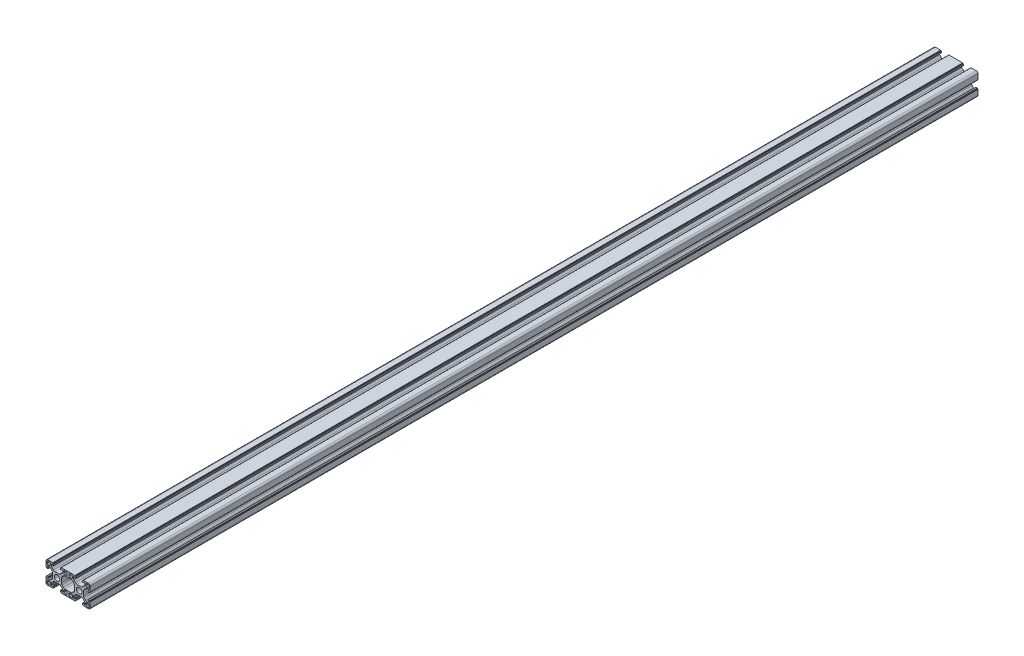
from build123d import *

# Parameters (mm, degrees)
EXTRUDE_1_DEPTH = 804


with BuildPart() as part:
    # Эскиз1 → Бобышка-Вытянуть1 (new body)
    with BuildSketch(Plane.XY):
        with BuildLine():
            Line((8.859007545, 4.035699369), (10.757788214, 4.035699369))
            ThreePointArc((10.757788214, 4.035699369), (11.523155079, 4.187940304), (12.172001777, 4.621485807))
            Line((12.172001777, 4.621485807), (13.473221107, 5.922705138))
            ThreePointArc((13.473221107, 5.922705138), (13.90676661, 6.571551836), (14.059007545, 7.3369187))
            Line((14.059007545, 7.3369187), (14.059007545, 8.235699369))
            ThreePointArc((14.059007545, 8.235699369), (13.912560936, 8.58925276), (13.559007545, 8.735699369))
            Line((13.559007545, 8.735699369), (13.456114326, 8.735699369))
            ThreePointArc((13.456114326, 8.735699369), (13.26477261, 8.697639136), (13.102560936, 8.58925276))
            Line((13.102560936, 8.58925276), (12.62223085, 8.108922674))
            ThreePointArc((12.62223085, 8.108922674), (12.541125013, 8.054729486), (12.445454154, 8.035699369))
            Line((12.445454154, 8.035699369), (12.159007545, 8.035699369))
            ThreePointArc((12.159007545, 8.035699369), (11.98223085, 8.108922674), (11.909007545, 8.285699369))
            Line((11.909007545, 8.285699369), (11.909007545, 9.43477019))
            ThreePointArc((11.909007545, 9.43477019), (11.952941528, 9.540836207), (12.059007545, 9.58477019))
            Line((12.059007545, 9.58477019), (12.559007545, 9.58477019))
            Line((12.559007545, 9.58477019), (12.559007545, 9.885699369))
            ThreePointArc((12.559007545, 9.885699369), (12.602941528, 9.991765387), (12.709007545, 10.035699369))
            Line((12.709007545, 10.035699369), (17.359007545, 10.035699369))
            ThreePointArc((17.359007545, 10.035699369), (18.419667717, 9.596359541), (18.859007545, 8.535699369))
            Line((18.859007545, 8.535699369), (18.859007545, 3.885699369))
            ThreePointArc((18.859007545, 3.885699369), (18.815073562, 3.779633352), (18.709007545, 3.735699369))
            Line((18.709007545, 3.735699369), (18.408078366, 3.735699369))
            Line((18.408078366, 3.735699369), (18.408078366, 3.235699369))
            ThreePointArc((18.408078366, 3.235699369), (18.364144383, 3.129633352), (18.258078366, 3.085699369))
            Line((18.258078366, 3.085699369), (17.109007545, 3.085699369))
            ThreePointArc((17.109007545, 3.085699369), (16.93223085, 3.158922674), (16.859007545, 3.335699369))
            Line((16.859007545, 3.335699369), (16.859007545, 3.622145979))
            ThreePointArc((16.859007545, 3.622145979), (16.878037662, 3.717816837), (16.93223085, 3.798922674))
            Line((16.93223085, 3.798922674), (17.412560936, 4.27925276))
            ThreePointArc((17.412560936, 4.27925276), (17.520947311, 4.441464434), (17.559007545, 4.632806151))
            Line((17.559007545, 4.632806151), (17.559007545, 4.735699369))
            ThreePointArc((17.559007545, 4.735699369), (17.412560936, 5.08925276), (17.059007545, 5.235699369))
            Line((17.059007545, 5.235699369), (16.160226876, 5.235699369))
            ThreePointArc((16.160226876, 5.235699369), (15.394860011, 5.083458434), (14.746013314, 4.649912932))
            Line((14.746013314, 4.649912932), (13.444793983, 3.348693601))
            ThreePointArc((13.444793983, 3.348693601), (13.01124848, 2.699846903), (12.859007545, 1.934480039))
            Line((12.859007545, 1.934480039), (12.859007545, 0.035699369))
            Line((12.859007545, 0.035699369), (12.859007545, -1.8630813))
            ThreePointArc((12.859007545, -1.8630813), (13.01124848, -2.628448164), (13.444793983, -3.277294862))
            Line((13.444793983, -3.277294862), (14.746013314, -4.578514193))
            ThreePointArc((14.746013314, -4.578514193), (15.394860011, -5.012059696), (16.160226876, -5.164300631))
            Line((16.160226876, -5.164300631), (17.059007545, -5.164300631))
            ThreePointArc((17.059007545, -5.164300631), (17.412560936, -5.017854021), (17.559007545, -4.664300631))
            Line((17.559007545, -4.664300631), (17.559007545, -4.561407412))
            ThreePointArc((17.559007545, -4.561407412), (17.520947311, -4.370065696), (17.412560936, -4.207854021))
            Line((17.412560936, -4.207854021), (16.93223085, -3.727523935))
            ThreePointArc((16.93223085, -3.727523935), (16.878037662, -3.646418098), (16.859007545, -3.55074724))
            Line((16.859007545, -3.55074724), (16.859007545, -3.264300631))
            ThreePointArc((16.859007545, -3.264300631), (16.93223085, -3.087523935), (17.109007545, -3.014300631))
            Line((17.109007545, -3.014300631), (18.258078366, -3.014300631))
            ThreePointArc((18.258078366, -3.014300631), (18.364144383, -3.058234613), (18.408078366, -3.164300631))
            Line((18.408078366, -3.164300631), (18.408078366, -3.664300631))
            Line((18.408078366, -3.664300631), (18.709007545, -3.664300631))
            ThreePointArc((18.709007545, -3.664300631), (18.815073562, -3.708234613), (18.859007545, -3.814300631))
            Line((18.859007545, -3.814300631), (18.859007545, -8.464300631))
            ThreePointArc((18.859007545, -8.464300631), (18.419667717, -9.524960802), (17.359007545, -9.964300631))
            Line((17.359007545, -9.964300631), (12.709007545, -9.964300631))
            ThreePointArc((12.709007545, -9.964300631), (12.602941528, -9.920366648), (12.559007545, -9.814300631))
            Line((12.559007545, -9.814300631), (12.559007545, -9.513371451))
            Line((12.559007545, -9.513371451), (12.059007545, -9.513371451))
            ThreePointArc((12.059007545, -9.513371451), (11.952941528, -9.469437468), (11.909007545, -9.363371451))
            Line((11.909007545, -9.363371451), (11.909007545, -8.214300631))
            ThreePointArc((11.909007545, -8.214300631), (11.98223085, -8.037523935), (12.159007545, -7.964300631))
            Line((12.159007545, -7.964300631), (12.445454154, -7.964300631))
            ThreePointArc((12.445454154, -7.964300631), (12.541125013, -7.983330747), (12.62223085, -8.037523935))
            Line((12.62223085, -8.037523935), (13.102560936, -8.517854021))
            ThreePointArc((13.102560936, -8.517854021), (13.26477261, -8.626240397), (13.456114326, -8.664300631))
            Line((13.456114326, -8.664300631), (13.559007545, -8.664300631))
            ThreePointArc((13.559007545, -8.664300631), (13.912560936, -8.517854021), (14.059007545, -8.164300631))
            Line((14.059007545, -8.164300631), (14.059007545, -7.265519961))
            ThreePointArc((14.059007545, -7.265519961), (13.90676661, -6.500153097), (13.473221107, -5.851306399))
            Line((13.473221107, -5.851306399), (12.172001777, -4.550087068))
            ThreePointArc((12.172001777, -4.550087068), (11.523155079, -4.116541566), (10.757788214, -3.964300631))
            Line((10.757788214, -3.964300631), (8.859007545, -3.964300631))
            Line((8.859007545, -3.964300631), (6.960226876, -3.964300631))
            ThreePointArc((6.960226876, -3.964300631), (6.194860011, -4.116541566), (5.546013314, -4.550087068))
            Line((5.546013314, -4.550087068), (4.244793983, -5.851306399))
            ThreePointArc((4.244793983, -5.851306399), (3.81124848, -6.500153097), (3.659007545, -7.265519961))
            Line((3.659007545, -7.265519961), (3.659007545, -8.164300631))
            ThreePointArc((3.659007545, -8.164300631), (3.805454154, -8.517854021), (4.159007545, -8.664300631))
            Line((4.159007545, -8.664300631), (4.261900764, -8.664300631))
            ThreePointArc((4.261900764, -8.664300631), (4.45324248, -8.626240397), (4.615454154, -8.517854021))
            Line((4.615454154, -8.517854021), (5.09578424, -8.037523935))
            ThreePointArc((5.09578424, -8.037523935), (5.176890078, -7.983330747), (5.272560936, -7.964300631))
            Line((5.272560936, -7.964300631), (5.559007545, -7.964300631))
            ThreePointArc((5.559007545, -7.964300631), (5.73578424, -8.037523935), (5.809007545, -8.214300631))
            Line((5.809007545, -8.214300631), (5.809007545, -9.363371451))
            ThreePointArc((5.809007545, -9.363371451), (5.765073562, -9.469437468), (5.659007545, -9.513371451))
            Line((5.659007545, -9.513371451), (5.159007545, -9.513371451))
            Line((5.159007545, -9.513371451), (5.159007545, -9.814300631))
            ThreePointArc((5.159007545, -9.814300631), (5.115073562, -9.920366648), (5.009007545, -9.964300631))
            Line((5.009007545, -9.964300631), (0.359007545, -9.964300631))
            Line((0.359007545, -9.964300631), (-2.640992455, -9.964300631))
            Line((-2.640992455, -9.964300631), (-7.290992455, -9.964300631))
            ThreePointArc((-7.290992455, -9.964300631), (-7.397058472, -9.920366648), (-7.440992455, -9.814300631))
            Line((-7.440992455, -9.814300631), (-7.440992455, -9.513371451))
            Line((-7.440992455, -9.513371451), (-7.940992455, -9.513371451))
            ThreePointArc((-7.940992455, -9.513371451), (-8.047058472, -9.469437468), (-8.090992455, -9.363371451))
            Line((-8.090992455, -9.363371451), (-8.090992455, -8.214300631))
            ThreePointArc((-8.090992455, -8.214300631), (-8.01776915, -8.037523935), (-7.840992455, -7.964300631))
            Line((-7.840992455, -7.964300631), (-7.554545846, -7.964300631))
            ThreePointArc((-7.554545846, -7.964300631), (-7.458874987, -7.983330747), (-7.37776915, -8.037523935))
            Line((-7.37776915, -8.037523935), (-6.897439064, -8.517854021))
            ThreePointArc((-6.897439064, -8.517854021), (-6.73522739, -8.626240397), (-6.543885674, -8.664300631))
            Line((-6.543885674, -8.664300631), (-6.440992455, -8.664300631))
            ThreePointArc((-6.440992455, -8.664300631), (-6.087439064, -8.517854021), (-5.940992455, -8.164300631))
            Line((-5.940992455, -8.164300631), (-5.940992455, -7.265519961))
            ThreePointArc((-5.940992455, -7.265519961), (-6.09323339, -6.500153097), (-6.526778893, -5.851306399))
            Line((-6.526778893, -5.851306399), (-7.827998223, -4.550087068))
            ThreePointArc((-7.827998223, -4.550087068), (-8.476844921, -4.116541566), (-9.242211786, -3.964300631))
            Line((-9.242211786, -3.964300631), (-11.140992455, -3.964300631))
            Line((-11.140992455, -3.964300631), (-13.039773124, -3.964300631))
            ThreePointArc((-13.039773124, -3.964300631), (-13.805139989, -4.116541566), (-14.453986686, -4.550087068))
            Line((-14.453986686, -4.550087068), (-15.755206017, -5.851306399))
            ThreePointArc((-15.755206017, -5.851306399), (-16.18875152, -6.500153097), (-16.340992455, -7.265519961))
            Line((-16.340992455, -7.265519961), (-16.340992455, -8.164300631))
            ThreePointArc((-16.340992455, -8.164300631), (-16.194545846, -8.517854021), (-15.840992455, -8.664300631))
            Line((-15.840992455, -8.664300631), (-15.738099236, -8.664300631))
            ThreePointArc((-15.738099236, -8.664300631), (-15.54675752, -8.626240397), (-15.384545846, -8.517854021))
            Line((-15.384545846, -8.517854021), (-14.90421576, -8.037523935))
            ThreePointArc((-14.90421576, -8.037523935), (-14.823109922, -7.983330747), (-14.727439064, -7.964300631))
            Line((-14.727439064, -7.964300631), (-14.440992455, -7.964300631))
            ThreePointArc((-14.440992455, -7.964300631), (-14.26421576, -8.037523935), (-14.190992455, -8.214300631))
            Line((-14.190992455, -8.214300631), (-14.190992455, -9.363371451))
            ThreePointArc((-14.190992455, -9.363371451), (-14.234926438, -9.469437468), (-14.340992455, -9.513371451))
            Line((-14.340992455, -9.513371451), (-14.840992455, -9.513371451))
            Line((-14.840992455, -9.513371451), (-14.840992455, -9.814300631))
            ThreePointArc((-14.840992455, -9.814300631), (-14.884926438, -9.920366648), (-14.990992455, -9.964300631))
            Line((-14.990992455, -9.964300631), (-19.640992455, -9.964300631))
            ThreePointArc((-19.640992455, -9.964300631), (-20.701652627, -9.524960802), (-21.140992455, -8.464300631))
            Line((-21.140992455, -8.464300631), (-21.140992455, -3.814300631))
            ThreePointArc((-21.140992455, -3.814300631), (-21.097058472, -3.708234613), (-20.990992455, -3.664300631))
            Line((-20.990992455, -3.664300631), (-20.690063275, -3.664300631))
            Line((-20.690063275, -3.664300631), (-20.690063275, -3.164300631))
            ThreePointArc((-20.690063275, -3.164300631), (-20.646129293, -3.058234613), (-20.540063275, -3.014300631))
            Line((-20.540063275, -3.014300631), (-19.390992455, -3.014300631))
            ThreePointArc((-19.390992455, -3.014300631), (-19.21421576, -3.087523935), (-19.140992455, -3.264300631))
            Line((-19.140992455, -3.264300631), (-19.140992455, -3.55074724))
            ThreePointArc((-19.140992455, -3.55074724), (-19.160022572, -3.646418098), (-19.21421576, -3.727523935))
            Line((-19.21421576, -3.727523935), (-19.694545846, -4.207854021))
            ThreePointArc((-19.694545846, -4.207854021), (-19.802932221, -4.370065696), (-19.840992455, -4.561407412))
            Line((-19.840992455, -4.561407412), (-19.840992455, -4.664300631))
            ThreePointArc((-19.840992455, -4.664300631), (-19.694545846, -5.017854021), (-19.340992455, -5.164300631))
            Line((-19.340992455, -5.164300631), (-18.442211786, -5.164300631))
            ThreePointArc((-18.442211786, -5.164300631), (-17.676844921, -5.012059696), (-17.027998223, -4.578514193))
            Line((-17.027998223, -4.578514193), (-15.726778893, -3.277294862))
            ThreePointArc((-15.726778893, -3.277294862), (-15.29323339, -2.628448164), (-15.140992455, -1.8630813))
            Line((-15.140992455, -1.8630813), (-15.140992455, 0.035699369))
            Line((-15.140992455, 0.035699369), (-15.140992455, 1.934480039))
            ThreePointArc((-15.140992455, 1.934480039), (-15.29323339, 2.699846903), (-15.726778893, 3.348693601))
            Line((-15.726778893, 3.348693601), (-17.027998223, 4.649912932))
            ThreePointArc((-17.027998223, 4.649912932), (-17.676844921, 5.083458434), (-18.442211786, 5.235699369))
            Line((-18.442211786, 5.235699369), (-19.340992455, 5.235699369))
            ThreePointArc((-19.340992455, 5.235699369), (-19.694545846, 5.08925276), (-19.840992455, 4.735699369))
            Line((-19.840992455, 4.735699369), (-19.840992455, 4.632806151))
            ThreePointArc((-19.840992455, 4.632806151), (-19.802932221, 4.441464434), (-19.694545846, 4.27925276))
            Line((-19.694545846, 4.27925276), (-19.21421576, 3.798922674))
            ThreePointArc((-19.21421576, 3.798922674), (-19.160022572, 3.717816837), (-19.140992455, 3.622145979))
            Line((-19.140992455, 3.622145979), (-19.140992455, 3.335699369))
            ThreePointArc((-19.140992455, 3.335699369), (-19.21421576, 3.158922674), (-19.390992455, 3.085699369))
            Line((-19.390992455, 3.085699369), (-20.540063275, 3.085699369))
            ThreePointArc((-20.540063275, 3.085699369), (-20.646129293, 3.129633352), (-20.690063275, 3.235699369))
            Line((-20.690063275, 3.235699369), (-20.690063275, 3.735699369))
            Line((-20.690063275, 3.735699369), (-20.990992455, 3.735699369))
            ThreePointArc((-20.990992455, 3.735699369), (-21.097058472, 3.779633352), (-21.140992455, 3.885699369))
            Line((-21.140992455, 3.885699369), (-21.140992455, 8.535699369))
            ThreePointArc((-21.140992455, 8.535699369), (-20.701652627, 9.596359541), (-19.640992455, 10.035699369))
            Line((-19.640992455, 10.035699369), (-14.990992455, 10.035699369))
            ThreePointArc((-14.990992455, 10.035699369), (-14.884926438, 9.991765387), (-14.840992455, 9.885699369))
            Line((-14.840992455, 9.885699369), (-14.840992455, 9.58477019))
            Line((-14.840992455, 9.58477019), (-14.340992455, 9.58477019))
            ThreePointArc((-14.340992455, 9.58477019), (-14.234926438, 9.540836207), (-14.190992455, 9.43477019))
            Line((-14.190992455, 9.43477019), (-14.190992455, 8.285699369))
            ThreePointArc((-14.190992455, 8.285699369), (-14.26421576, 8.108922674), (-14.440992455, 8.035699369))
            Line((-14.440992455, 8.035699369), (-14.727439064, 8.035699369))
            ThreePointArc((-14.727439064, 8.035699369), (-14.823109922, 8.054729486), (-14.90421576, 8.108922674))
            Line((-14.90421576, 8.108922674), (-15.384545846, 8.58925276))
            ThreePointArc((-15.384545846, 8.58925276), (-15.54675752, 8.697639136), (-15.738099236, 8.735699369))
            Line((-15.738099236, 8.735699369), (-15.840992455, 8.735699369))
            ThreePointArc((-15.840992455, 8.735699369), (-16.194545846, 8.58925276), (-16.340992455, 8.235699369))
            Line((-16.340992455, 8.235699369), (-16.340992455, 7.3369187))
            ThreePointArc((-16.340992455, 7.3369187), (-16.18875152, 6.571551836), (-15.755206017, 5.922705138))
            Line((-15.755206017, 5.922705138), (-14.453986686, 4.621485807))
            ThreePointArc((-14.453986686, 4.621485807), (-13.805139989, 4.187940304), (-13.039773124, 4.035699369))
            Line((-13.039773124, 4.035699369), (-11.140992455, 4.035699369))
            Line((-11.140992455, 4.035699369), (-9.242211786, 4.035699369))
            ThreePointArc((-9.242211786, 4.035699369), (-8.476844921, 4.187940304), (-7.827998223, 4.621485807))
            Line((-7.827998223, 4.621485807), (-6.526778893, 5.922705138))
            ThreePointArc((-6.526778893, 5.922705138), (-6.09323339, 6.571551836), (-5.940992455, 7.3369187))
            Line((-5.940992455, 7.3369187), (-5.940992455, 8.235699369))
            ThreePointArc((-5.940992455, 8.235699369), (-6.087439064, 8.58925276), (-6.440992455, 8.735699369))
            Line((-6.440992455, 8.735699369), (-6.543885674, 8.735699369))
            ThreePointArc((-6.543885674, 8.735699369), (-6.73522739, 8.697639136), (-6.897439064, 8.58925276))
            Line((-6.897439064, 8.58925276), (-7.37776915, 8.108922674))
            ThreePointArc((-7.37776915, 8.108922674), (-7.458874987, 8.054729486), (-7.554545846, 8.035699369))
            Line((-7.554545846, 8.035699369), (-7.840992455, 8.035699369))
            ThreePointArc((-7.840992455, 8.035699369), (-8.01776915, 8.108922674), (-8.090992455, 8.285699369))
            Line((-8.090992455, 8.285699369), (-8.090992455, 9.43477019))
            ThreePointArc((-8.090992455, 9.43477019), (-8.047058472, 9.540836207), (-7.940992455, 9.58477019))
            Line((-7.940992455, 9.58477019), (-7.440992455, 9.58477019))
            Line((-7.440992455, 9.58477019), (-7.440992455, 9.885699369))
            ThreePointArc((-7.440992455, 9.885699369), (-7.397058472, 9.991765387), (-7.290992455, 10.035699369))
            Line((-7.290992455, 10.035699369), (-2.640992455, 10.035699369))
            Line((-2.640992455, 10.035699369), (0.359007545, 10.035699369))
            Line((0.359007545, 10.035699369), (5.009007545, 10.035699369))
            ThreePointArc((5.009007545, 10.035699369), (5.115073562, 9.991765387), (5.159007545, 9.885699369))
            Line((5.159007545, 9.885699369), (5.159007545, 9.58477019))
            Line((5.159007545, 9.58477019), (5.659007545, 9.58477019))
            ThreePointArc((5.659007545, 9.58477019), (5.765073562, 9.540836207), (5.809007545, 9.43477019))
            Line((5.809007545, 9.43477019), (5.809007545, 8.285699369))
            ThreePointArc((5.809007545, 8.285699369), (5.73578424, 8.108922674), (5.559007545, 8.035699369))
            Line((5.559007545, 8.035699369), (5.272560936, 8.035699369))
            ThreePointArc((5.272560936, 8.035699369), (5.176890078, 8.054729486), (5.09578424, 8.108922674))
            Line((5.09578424, 8.108922674), (4.615454154, 8.58925276))
            ThreePointArc((4.615454154, 8.58925276), (4.45324248, 8.697639136), (4.261900764, 8.735699369))
            Line((4.261900764, 8.735699369), (4.159007545, 8.735699369))
            ThreePointArc((4.159007545, 8.735699369), (3.805454154, 8.58925276), (3.659007545, 8.235699369))
            Line((3.659007545, 8.235699369), (3.659007545, 7.3369187))
            ThreePointArc((3.659007545, 7.3369187), (3.81124848, 6.571551836), (4.244793983, 5.922705138))
            Line((4.244793983, 5.922705138), (5.546013314, 4.621485807))
            ThreePointArc((5.546013314, 4.621485807), (6.194860011, 4.187940304), (6.960226876, 4.035699369))
            Line((6.960226876, 4.035699369), (8.859007545, 4.035699369))
        make_face()
        with BuildLine():
            Line((15.759007545, 6.135699369), (17.159007545, 6.135699369))
            ThreePointArc((17.159007545, 6.135699369), (17.72469297, 6.370013944), (17.959007545, 6.935699369))
            Line((17.959007545, 6.935699369), (17.959007545, 8.335699369))
            ThreePointArc((17.959007545, 8.335699369), (17.72469297, 8.901384794), (17.159007545, 9.135699369))
            Line((17.159007545, 9.135699369), (15.759007545, 9.135699369))
            ThreePointArc((15.759007545, 9.135699369), (15.19332212, 8.901384794), (14.959007545, 8.335699369))
            Line((14.959007545, 8.335699369), (14.959007545, 6.935699369))
            ThreePointArc((14.959007545, 6.935699369), (15.19332212, 6.370013944), (15.759007545, 6.135699369))
        make_face(mode=Mode.SUBTRACT)
        with BuildLine():
            Line((14.959007545, -6.864300631), (14.959007545, -8.264300631))
            ThreePointArc((14.959007545, -8.264300631), (15.19332212, -8.829986056), (15.759007545, -9.064300631))
            Line((15.759007545, -9.064300631), (17.159007545, -9.064300631))
            ThreePointArc((17.159007545, -9.064300631), (17.72469297, -8.829986056), (17.959007545, -8.264300631))
            Line((17.959007545, -8.264300631), (17.959007545, -6.864300631))
            ThreePointArc((17.959007545, -6.864300631), (17.72469297, -6.298615206), (17.159007545, -6.064300631))
            Line((17.159007545, -6.064300631), (15.759007545, -6.064300631))
            ThreePointArc((15.759007545, -6.064300631), (15.19332212, -6.298615206), (14.959007545, -6.864300631))
        make_face(mode=Mode.SUBTRACT)
        with BuildLine():
            Line((1.959007545, -6.064300631), (0.559007545, -6.064300631))
            ThreePointArc((0.559007545, -6.064300631), (-0.00667788, -6.298615206), (-0.240992455, -6.864300631))
            Line((-0.240992455, -6.864300631), (-0.240992455, -8.264300631))
            ThreePointArc((-0.240992455, -8.264300631), (-0.00667788, -8.829986056), (0.559007545, -9.064300631))
            Line((0.559007545, -9.064300631), (1.959007545, -9.064300631))
            ThreePointArc((1.959007545, -9.064300631), (2.52469297, -8.829986056), (2.759007545, -8.264300631))
            Line((2.759007545, -8.264300631), (2.759007545, -6.864300631))
            ThreePointArc((2.759007545, -6.864300631), (2.52469297, -6.298615206), (1.959007545, -6.064300631))
        make_face(mode=Mode.SUBTRACT)
        with BuildLine():
            Line((0.659007545, -5.164300631), (1.557788214, -5.164300631))
            ThreePointArc((1.557788214, -5.164300631), (2.323155079, -5.012059696), (2.972001777, -4.578514193))
            Line((2.972001777, -4.578514193), (4.273221107, -3.277294862))
            ThreePointArc((4.273221107, -3.277294862), (4.70676661, -2.628448164), (4.859007545, -1.8630813))
            Line((4.859007545, -1.8630813), (4.859007545, 0.035699369))
            Line((4.859007545, 0.035699369), (4.859007545, 1.934480039))
            ThreePointArc((4.859007545, 1.934480039), (4.70676661, 2.699846903), (4.273221107, 3.348693601))
            Line((4.273221107, 3.348693601), (2.972001777, 4.649912932))
            ThreePointArc((2.972001777, 4.649912932), (2.323155079, 5.083458434), (1.557788214, 5.235699369))
            Line((1.557788214, 5.235699369), (0.659007545, 5.235699369))
            Line((0.659007545, 5.235699369), (-2.940992455, 5.235699369))
            Line((-2.940992455, 5.235699369), (-3.839773124, 5.235699369))
            ThreePointArc((-3.839773124, 5.235699369), (-4.605139989, 5.083458434), (-5.253986686, 4.649912932))
            Line((-5.253986686, 4.649912932), (-6.555206017, 3.348693601))
            ThreePointArc((-6.555206017, 3.348693601), (-6.98875152, 2.699846903), (-7.140992455, 1.934480039))
            Line((-7.140992455, 1.934480039), (-7.140992455, 0.035699369))
            Line((-7.140992455, 0.035699369), (-7.140992455, -1.8630813))
            ThreePointArc((-7.140992455, -1.8630813), (-6.98875152, -2.628448164), (-6.555206017, -3.277294862))
            Line((-6.555206017, -3.277294862), (-5.253986686, -4.578514193))
            ThreePointArc((-5.253986686, -4.578514193), (-4.605139989, -5.012059696), (-3.839773124, -5.164300631))
            Line((-3.839773124, -5.164300631), (-2.940992455, -5.164300631))
            Line((-2.940992455, -5.164300631), (0.659007545, -5.164300631))
        make_face(mode=Mode.SUBTRACT)
        with BuildLine():
            Line((2.759007545, 6.935699369), (2.759007545, 8.335699369))
            ThreePointArc((2.759007545, 8.335699369), (2.52469297, 8.901384794), (1.959007545, 9.135699369))
            Line((1.959007545, 9.135699369), (0.559007545, 9.135699369))
            ThreePointArc((0.559007545, 9.135699369), (-0.00667788, 8.901384794), (-0.240992455, 8.335699369))
            Line((-0.240992455, 8.335699369), (-0.240992455, 6.935699369))
            ThreePointArc((-0.240992455, 6.935699369), (-0.00667788, 6.370013944), (0.559007545, 6.135699369))
            Line((0.559007545, 6.135699369), (1.959007545, 6.135699369))
            ThreePointArc((1.959007545, 6.135699369), (2.52469297, 6.370013944), (2.759007545, 6.935699369))
        make_face(mode=Mode.SUBTRACT)
        with BuildLine():
            Line((-2.840992455, 9.135699369), (-4.240992455, 9.135699369))
            ThreePointArc((-4.240992455, 9.135699369), (-4.80667788, 8.901384794), (-5.040992455, 8.335699369))
            Line((-5.040992455, 8.335699369), (-5.040992455, 6.935699369))
            ThreePointArc((-5.040992455, 6.935699369), (-4.80667788, 6.370013944), (-4.240992455, 6.135699369))
            Line((-4.240992455, 6.135699369), (-2.840992455, 6.135699369))
            ThreePointArc((-2.840992455, 6.135699369), (-2.27530703, 6.370013944), (-2.040992455, 6.935699369))
            Line((-2.040992455, 6.935699369), (-2.040992455, 8.335699369))
            ThreePointArc((-2.040992455, 8.335699369), (-2.27530703, 8.901384794), (-2.840992455, 9.135699369))
        make_face(mode=Mode.SUBTRACT)
        with BuildLine():
            Line((-2.040992455, -8.264300631), (-2.040992455, -6.864300631))
            ThreePointArc((-2.040992455, -6.864300631), (-2.27530703, -6.298615206), (-2.840992455, -6.064300631))
            Line((-2.840992455, -6.064300631), (-4.240992455, -6.064300631))
            ThreePointArc((-4.240992455, -6.064300631), (-4.80667788, -6.298615206), (-5.040992455, -6.864300631))
            Line((-5.040992455, -6.864300631), (-5.040992455, -8.264300631))
            ThreePointArc((-5.040992455, -8.264300631), (-4.80667788, -8.829986056), (-4.240992455, -9.064300631))
            Line((-4.240992455, -9.064300631), (-2.840992455, -9.064300631))
            ThreePointArc((-2.840992455, -9.064300631), (-2.27530703, -8.829986056), (-2.040992455, -8.264300631))
        make_face(mode=Mode.SUBTRACT)
        with BuildLine():
            Line((-19.440992455, -9.064300631), (-18.040992455, -9.064300631))
            ThreePointArc((-18.040992455, -9.064300631), (-17.47530703, -8.829986056), (-17.240992455, -8.264300631))
            Line((-17.240992455, -8.264300631), (-17.240992455, -6.864300631))
            ThreePointArc((-17.240992455, -6.864300631), (-17.47530703, -6.298615206), (-18.040992455, -6.064300631))
            Line((-18.040992455, -6.064300631), (-19.440992455, -6.064300631))
            ThreePointArc((-19.440992455, -6.064300631), (-20.00667788, -6.298615206), (-20.240992455, -6.864300631))
            Line((-20.240992455, -6.864300631), (-20.240992455, -8.264300631))
            ThreePointArc((-20.240992455, -8.264300631), (-20.00667788, -8.829986056), (-19.440992455, -9.064300631))
        make_face(mode=Mode.SUBTRACT)
        with BuildLine():
            Line((-20.240992455, 8.335699369), (-20.240992455, 6.935699369))
            ThreePointArc((-20.240992455, 6.935699369), (-20.00667788, 6.370013944), (-19.440992455, 6.135699369))
            Line((-19.440992455, 6.135699369), (-18.040992455, 6.135699369))
            ThreePointArc((-18.040992455, 6.135699369), (-17.47530703, 6.370013944), (-17.240992455, 6.935699369))
            Line((-17.240992455, 6.935699369), (-17.240992455, 8.335699369))
            ThreePointArc((-17.240992455, 8.335699369), (-17.47530703, 8.901384794), (-18.040992455, 9.135699369))
            Line((-18.040992455, 9.135699369), (-19.440992455, 9.135699369))
            ThreePointArc((-19.440992455, 9.135699369), (-20.00667788, 8.901384794), (-20.240992455, 8.335699369))
        make_face(mode=Mode.SUBTRACT)
        with BuildLine():
            ThreePointArc((11.359007545, 0.035699369), (10.626774498, 1.803466322), (8.859007545, 2.535699369))
            ThreePointArc((8.859007545, 2.535699369), (7.091240592, 1.803466322), (6.359007545, 0.035699369))
            ThreePointArc((6.359007545, 0.035699369), (7.091240592, -1.732067584), (8.859007545, -2.464300631))
            ThreePointArc((8.859007545, -2.464300631), (10.626774498, -1.732067584), (11.359007545, 0.035699369))
        make_face(mode=Mode.SUBTRACT)
        with BuildLine():
            ThreePointArc((-11.140992455, 2.535699369), (-9.373225502, 1.803466322), (-8.640992455, 0.035699369))
            ThreePointArc((-8.640992455, 0.035699369), (-9.373225502, -1.732067584), (-11.140992455, -2.464300631))
            ThreePointArc((-11.140992455, -2.464300631), (-12.908759408, -1.732067584), (-13.640992455, 0.035699369))
            ThreePointArc((-13.640992455, 0.035699369), (-12.908759408, 1.803466322), (-11.140992455, 2.535699369))
        make_face(mode=Mode.SUBTRACT)
    extrude(amount=EXTRUDE_1_DEPTH)


solid = part.part
